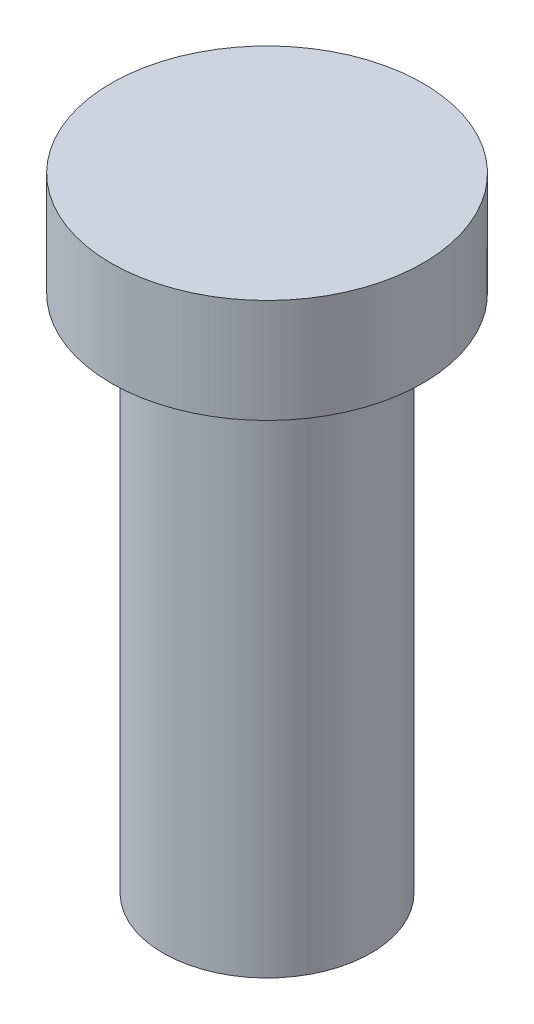
from build123d import *

# Parameters (mm, degrees)
ESQUISSE1_R      = 2
EXTRUSION1_DEPTH = 10
ESQUISSE2_R      = 3
EXTRUSION2_DEPTH = 2


with BuildPart() as part:
    # Esquisse1 → Extrusion1 (new body)
    with BuildSketch(Plane(origin=(0, 0, 0), x_dir=(1, 0, 0), z_dir=(0, 1, 0))):
        with Locations(Location((0, 0, 0), (0, 0, 270))):
            Circle(ESQUISSE1_R)
    extrude(amount=EXTRUSION1_DEPTH)

    # Esquisse2 → Extrusion2 (add)
    with BuildSketch(Plane(origin=(0, 10, 0), x_dir=(1, 0, 0), z_dir=(0, 1, 0))):
        with Locations(Location((0, 0, 0), (0, 0, 270))):
            Circle(ESQUISSE2_R)
    extrude(amount=EXTRUSION2_DEPTH)


solid = part.part
